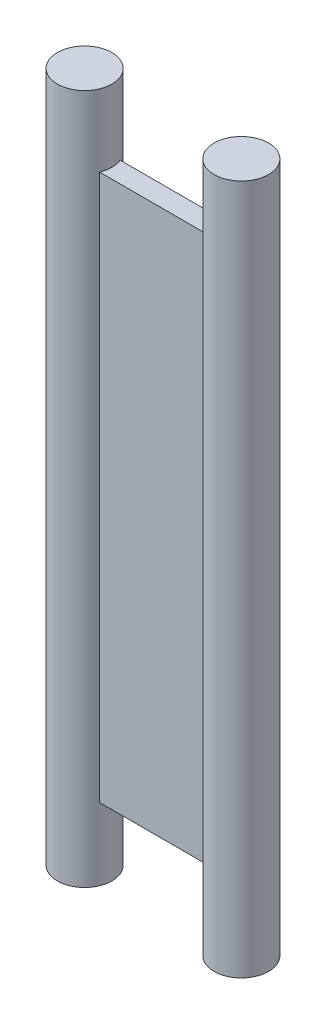
from build123d import *

# Parameters (mm, degrees)
SKETCH1_W           = 7.606
SKETCH1_H           = 1
BOSS_EXTRUDE1_DEPTH = 26.5
SKETCH2_R           = 1.325
BOSS_EXTRUDE2_DEPTH = 16.75


with BuildPart() as part:
    # Sketch1 → Boss-Extrude1 (new body)
    with BuildSketch(Plane(origin=(0, 0, 0), x_dir=(1, 0, 0), z_dir=(0, 1, 0))):
        Rectangle(SKETCH1_W, SKETCH1_H)
    extrude(amount=BOSS_EXTRUDE1_DEPTH)

    # Sketch2 → Boss-Extrude2 (add, symmetric)
    with BuildSketch(Plane(origin=(0, 13.25, 0), x_dir=(1, 0, 0), z_dir=(0, 1, 0))):
        with Locations(Location((-3.803, 0, 0), (0, 0, 270))):
            Circle(SKETCH2_R)
        with Locations(Location((3.803, 0, 0), (0, 0, 270))):
            Circle(SKETCH2_R)
    extrude(amount=BOSS_EXTRUDE2_DEPTH, both=True)


solid = part.part
